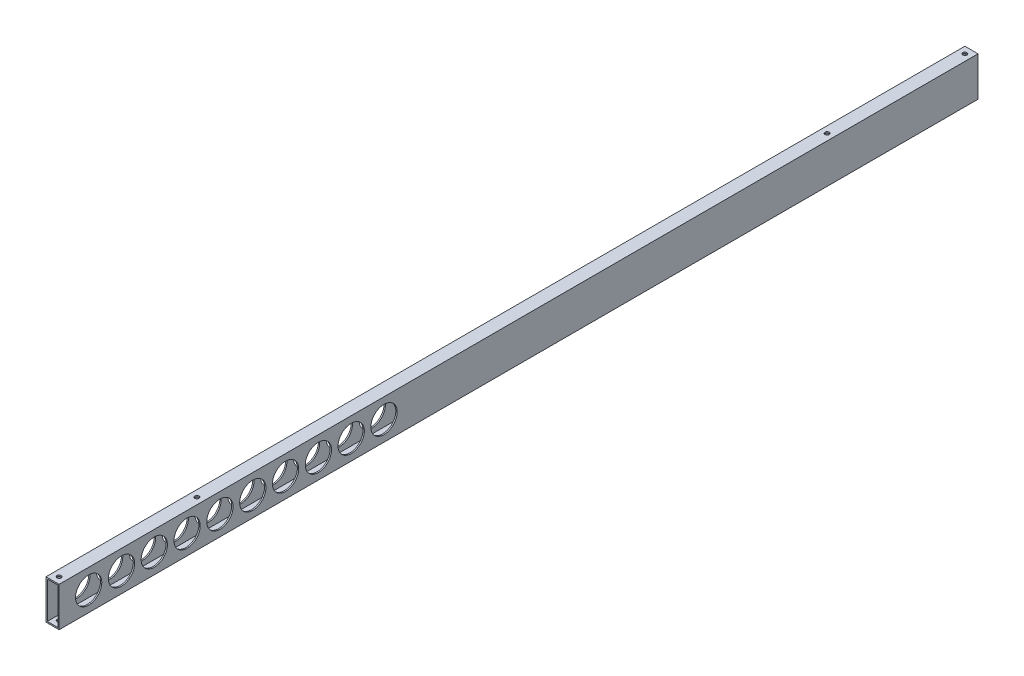
from build123d import *

# Parameters (mm, degrees)
SKETCH_1_W          = 10
SKETCH_1_H          = 30
SKETCH_1_W_2        = 8
SKETCH_1_H_2        = 28
EXTRUDE_1_DEPTH     = 700
SKETCH_2_R          = 1.6
CUT_EXTRUDE_1_DEPTH = 701.660402763
SKETCH_3_R          = 10
CUT_EXTRUDE_2_DEPTH = 701.232104377


with BuildPart() as part:
    # ｽｹｯﾁ1 → 押し出し-薄板1 (new body)
    with BuildSketch(Plane.XY):
        Rectangle(SKETCH_1_W, SKETCH_1_H)
        Rectangle(SKETCH_1_W_2, SKETCH_1_H_2, mode=Mode.SUBTRACT)
    extrude(amount=EXTRUDE_1_DEPTH)

    # ｽｹｯﾁ2 → ｶｯﾄ - 押し出し1 (cut, through all)
    with BuildSketch(Plane(origin=(0, 15, 0), x_dir=(1, 0, 0), z_dir=(0, 1, 0))):
        with Locations(Location((0, -5, 0), (0, 0, 270))):
            Circle(SKETCH_2_R)
        with Locations(Location((0, -110, 0), (0, 0, 270))):
            Circle(SKETCH_2_R)
        with Locations(Location((0, -695, 0), (0, 0, 90))):
            Circle(SKETCH_2_R)
        with Locations(Location((0, -590, 0), (0, 0, 90))):
            Circle(SKETCH_2_R)
    extrude(amount=-CUT_EXTRUDE_1_DEPTH, mode=Mode.SUBTRACT)

    # ｽｹｯﾁ3 → ｶｯﾄ - 押し出し2 (cut, through all)
    with BuildSketch(Plane(origin=(5, 0, 0), x_dir=(0, 0, -1), z_dir=(1, 0, 0))):
        with Locations((-677.5, 0)):
            Circle(SKETCH_3_R)
        with Locations((-652.5, 0)):
            Circle(SKETCH_3_R)
        with Locations((-627.5, 0)):
            Circle(SKETCH_3_R)
        with Locations((-602.5, 0)):
            Circle(SKETCH_3_R)
        with Locations((-577.5, 0)):
            Circle(SKETCH_3_R)
        with Locations((-552.5, 0)):
            Circle(SKETCH_3_R)
        with Locations((-527.5, 0)):
            Circle(SKETCH_3_R)
        with Locations((-502.5, 0)):
            Circle(SKETCH_3_R)
        with Locations((-477.5, 0)):
            Circle(SKETCH_3_R)
        with Locations((-452.5, 0)):
            Circle(SKETCH_3_R)
    extrude(amount=-CUT_EXTRUDE_2_DEPTH, mode=Mode.SUBTRACT)


solid = part.part
